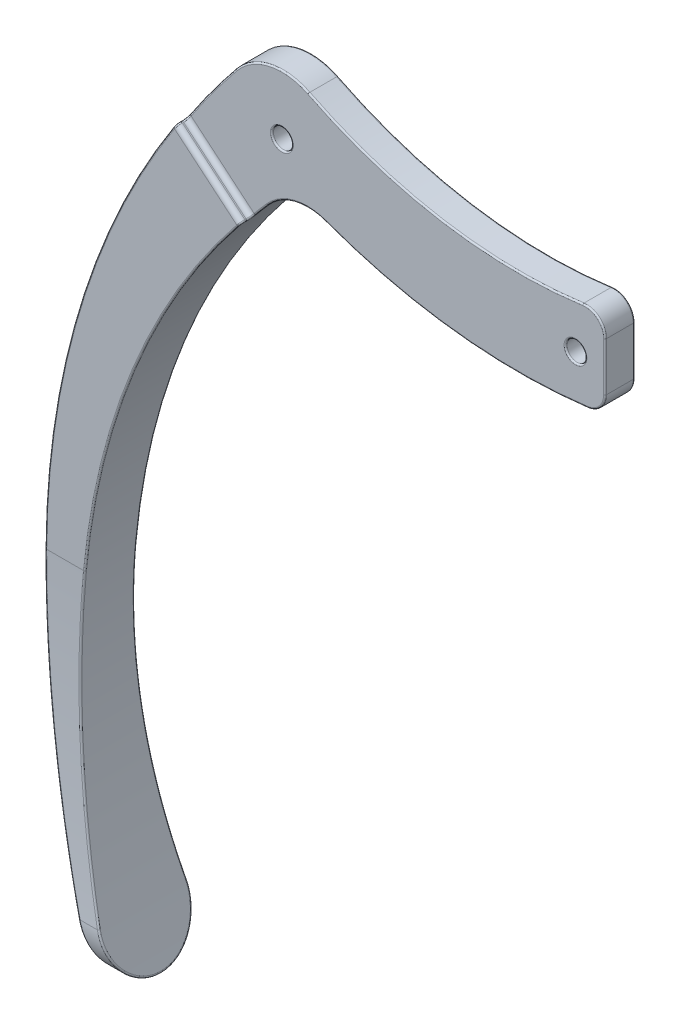
from build123d import *

# Parameters (mm, degrees)
BOSS_EXTRUDE1_DEPTH = 5
CUT_EXTRUDE1_DEPTH  = 96.82755078110858
SKETCH6_R           = 1.0000000000000009
SKETCH6_R_2         = 1
BOSS_EXTRUDE2_DEPTH = 1.5
FILLET1_R           = 2
FILLET2_R           = 0.5
FILLET3_R           = 0.15


with BuildPart() as part:
    # Sketch2 → Boss-Extrude1 (new, symmetric)
    with BuildSketch(Plane.XY):
        with BuildLine():
            Line((-47.879999999999995, -77.96), (-46.07999999999999, -77.95999999999998))
            ThreePointArc((-46.07999999999999, -77.95999999999998), (-51.087318380463614, -40.04954657190723), (-35.70457061065488, -5.0403079692560135))
            Line((-35.70457061065488, -5.0403079692560135), (-42.257561531009266, 0.4583042951214721))
            ThreePointArc((-42.257561531009266, 0.4583042951214721), (-55.293054999289076, -38.01778746193144), (-47.879999999999995, -77.96))
        make_face()
    extrude(amount=BOSS_EXTRUDE1_DEPTH, both=True)

    # Sketch3 → Cut-Extrude1 (cut, through all)
    with BuildSketch(Plane(origin=(0, 0, 0), x_dir=(0, 0, -1), z_dir=(1, 0, 0))):
        with BuildLine():
            Line((2.6249999999999885, -43.341695704878504), (2.625, 5.158304295121475))
            Line((2.625, 5.158304295121475), (26.455936468823925, 5.158304295121475))
            Line((26.455936468823925, 5.158304295121475), (26.455936468823925, -83.62686309331454))
            Line((26.455936468823925, -83.62686309331454), (-38.72297878348456, -83.62686309331568))
            Line((-38.72297878348456, -83.62686309331568), (-38.72297878348456, 5.158304295121475))
            Line((-38.72297878348456, 5.158304295121475), (-2.625, 5.158304295121475))
            Line((-2.625, 5.158304295121475), (-2.6249999999999885, -43.341695704878504))
            ThreePointArc((-2.6249999999999885, -43.341695704878504), (-3.0851603844788826, -57.83601813806842), (-4.4637882012124255, -72.271963403954))
            ThreePointArc((-4.4637882012124255, -72.271963403954), (2.8e-16, -77.34169570487853), (4.4637882012124255, -72.271963403954))
            ThreePointArc((4.4637882012124255, -72.271963403954), (3.085160384478854, -57.83601813806835), (2.6249999999999885, -43.341695704878504))
        make_face()
    extrude(amount=-CUT_EXTRUDE1_DEPTH, mode=Mode.SUBTRACT)

    # Sketch6 → Boss-Extrude2 (add, symmetric)
    with BuildSketch(Plane.XY):
        with BuildLine():
            ThreePointArc((-29.999999999999993, 8.723260799028404), (-15.346652662818457, 4.1491777167562915), (-1.9e-15, 4.5))
            Line((-1.9e-15, 4.5), (8.3e-16, -4.5))
            ThreePointArc((8.3e-16, -4.5), (-14.305044942599498, -4.907658519922634), (-28.250000000000004, -1.6922697835896754))
            ThreePointArc((-28.250000000000004, -1.6922697835896754), (-31.41756111786321, -1.5236183421697334), (-34.123863182331654, -3.178253008779153))
            ThreePointArc((-34.123863182331654, -3.178253008779153), (-34.922224705620565, -4.102482621263533), (-35.70457061065488, -5.040307969256014))
            Line((-35.70457061065488, -5.040307969256014), (-42.257561531009266, 0.4583042951214755))
            ThreePointArc((-42.257561531009266, 0.4583042951214755), (-39.88451481807913, 3.871306317451655), (-37.338447860378025, 7.157257709831201))
            ThreePointArc((-37.338447860378025, 7.157257709831201), (-33.94423047686867, 9.228967570519943), (-29.999999999999993, 8.723260799028404))
        make_face()
        with Locations((-32.692042069218274, 3.3610868464641115)):
            Circle(SKETCH6_R, mode=Mode.SUBTRACT)
        with Locations((-2.999999999999999, -0.42367787139200375)):
            Circle(SKETCH6_R_2, mode=Mode.SUBTRACT)
    extrude(amount=BOSS_EXTRUDE2_DEPTH, both=True)

    # Fillet1
    fillet1_edges = [part.edges().sort_by_distance(p)[0] for p in [
        (1.71e-15, 4.5, 0),
        (-4.7e-16, -4.4999999999999964, 0),
    ]]
    fillet(fillet1_edges, radius=FILLET1_R)

    # Fillet2
    fillet2_edges = [part.edges().sort_by_distance(p)[0] for p in [
        (-38.98106607083208, -2.2910018370672702, 2.624999999999998),
        (-38.98106607083208, -2.2910018370672702, -2.6249999999999982),
        (-38.98106607083207, -2.2910018370672693, -1.5),
        (-38.98106607083207, -2.2910018370672693, 1.5),
    ]]
    fillet(fillet2_edges, radius=FILLET2_R)

    # Fillet3
    fillet3_edges = [part.edges().sort_by_distance(p)[0] for p in [
        (-42.25756153100927, 0.45830429512147214, -2.0625),
        (-35.70457061065488, -5.040307969256013, -2.062499999999999),
        (-42.25756153100927, 0.45830429512147214, 2.062499999999999),
        (-52.12786339911793, -20.722268105502728, -2.6249999999999885),
        (-42.3388355774434, 0.33447524229432607, 2.479206073933231),
        (-42.3388355774434, 0.33447524229432707, -2.479206073933233),
        (-35.70457061065488, -5.040307969256013, 2.0624999999999982),
        (-46.54112927836407, -23.246528836950045, 2.6249999999999867),
        (-35.79730969170801, -5.153679964934518, 2.4785662912886095),
        (-35.797309691708, -5.15367996493452, -2.478566291288611),
        (-35.61160735875994, -4.927139091927203, -1.6464452027330532),
        (-42.17613528053602, 0.5818692501353199, -1.6458980392882598),
        (-35.61160735875994, -4.927139091927202, 1.6464452027330534),
        (-42.17613528053602, 0.5818692501353209, 1.6458980392882587),
        (-54.219059810420326, -58.07362039189638, -3.100386513118472),
        (-48.16683304401135, -77.34169570487855, 3.52e-15),
        (-54.219059810420305, -58.073620391896384, 3.1003865131184747),
        (-52.12786339911793, -20.72226810550273, 2.6249999999999885),
        (-51.3486030596005, -58.00284368481578, 3.0958249794241928),
        (-46.34087299431121, -77.34169570487852, 3.58e-15),
        (-51.348603059600535, -58.00284368481575, -3.0958249794241928),
        (-46.54112927836407, -23.246528836950045, -2.6249999999999867),
        (-16.48492872591084, 4.323550998030434, 1.5),
        (-33.94423047686867, 9.228967570519945, -1.5),
        (-39.735274634079516, 4.073880400720256, -1.5),
        (-34.76009312834042, -3.9121736621842302, 1.5),
        (-31.41756111786321, -1.5236183421697316, 1.5),
        (-15.184440202618344, -4.81326903490389, -1.5),
        (-33.692042069218274, 3.3610868464641115, 1.5),
        (-3.999999999999999, -0.42367787139200364, 1.5),
        (-33.94423047686867, 9.228967570519945, 1.5),
        (-39.735274634079516, 4.073880400720256, 1.5),
        (-15.184440202618344, -4.81326903490389, 1.5),
        (-16.48492872591084, 4.323550998030434, -1.5),
        (-31.41756111786321, -1.5236183421697316, -1.5),
        (-34.76009312834042, -3.9121736621842302, -1.5),
        (-33.692042069218274, 3.3610868464641115, -1.5),
        (-3.999999999999999, -0.42367787139200364, -1.5),
        (-4.4e-16, -0.30696768972093835, -1.5),
        (-4.4e-16, -0.30696768972093835, 1.5),
        (-0.6858689501842179, 3.656624074549244, -1.5),
        (-0.5004843654322972, -4.086317191688743, -1.5),
        (-0.6858689501842179, 3.656624074549244, 1.5),
        (-0.5004843654322972, -4.086317191688743, 1.5),
    ]]
    fillet(fillet3_edges, radius=FILLET3_R)


solid = part.part
